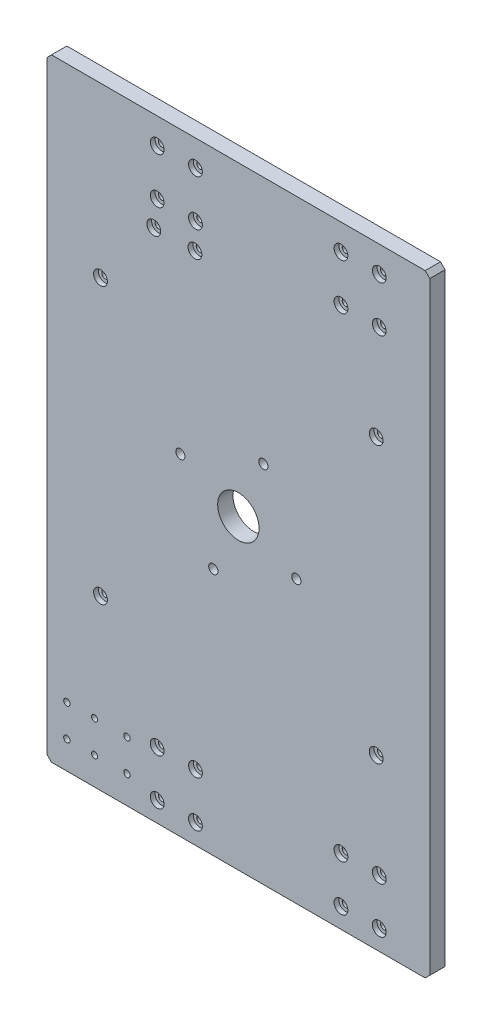
from build123d import *

# Parameters (mm, degrees)
ESQUISSE1_W                                  = 250
ESQUISSE1_H                                  = 400
BOSS_EXTRU_1_DEPTH                           = 10
ESQUISSE2_R                                  = 13.5
ENL_V_MAT_EXTRU_1_DEPTH                      = 237.061432682
CHANFREIN1_SIZE                              = 3
TROU_TARAUD_M51_D                            = 4.2
TROUS_DE_CENTRAGE_4_0MM2_D                   = 4
TROUS_DE_CENTRAGE_6_0MM2_D                   = 6
D_GAGEMENT_M41_D                             = 4.5
R_P_TITION_LIN_AIRE1_COUNT                   = 2
R_P_TITION_LIN_AIRE1_PITCH                   = 120
R_P_TITION_LIN_AIRE1_COUNT_DIR2              = 2
R_P_TITION_LIN_AIRE1_PITCH_DIR2              = 340
R_P_TITION_LIN_AIRE2_COUNT                   = 2
R_P_TITION_LIN_AIRE2_PITCH                   = 30
R_P_TITION_LIN_AIRE2_COUNT_DIR2              = 2
R_P_TITION_LIN_AIRE2_PITCH_DIR2              = 25
R_P_TITION_LIN_AIRE3_COUNT                   = 2
R_P_TITION_LIN_AIRE3_PITCH                   = 120
R_P_TITION_LIN_AIRE3_COUNT_DIR2              = 2
R_P_TITION_LIN_AIRE3_PITCH_DIR2              = 340
D_GAGEMENT_M42_D                             = 4.5
CHAMBRAGE_POUR_VIS_T_TE_RONDE_BOMB_2_A_COUNT = 2
CHAMBRAGE_POUR_VIS_T_TE_RONDE_BOMB_2_A_PITCH = 180
CHAMBRAGE_POUR_VIS_T_TE_RONDE_BOMB_3_COUNT   = 2
CHAMBRAGE_POUR_VIS_T_TE_RONDE_BOMB_3_PITCH   = 180
CHAMBRAGE_POUR_VIS_T_TE_RONDE_BOMB_4_COUNT   = 2
CHAMBRAGE_POUR_VIS_T_TE_RONDE_BOMB_4_PITCH   = 254.558441227
D_GAGEMENT_M43_D                             = 4.5
CHAMBRAGE_POUR_VIS_T_TE_RONDE_BOMB_5_A_COUNT = 2
CHAMBRAGE_POUR_VIS_T_TE_RONDE_BOMB_5_A_PITCH = 26.858717456


with BuildPart() as part:
    # Esquisse1 → Boss.-Extru.1 (new body)
    with BuildSketch(Plane.XY):
        Rectangle(ESQUISSE1_W, ESQUISSE1_H)
    extrude(amount=BOSS_EXTRU_1_DEPTH)

    # Esquisse2 → Enlèv. mat.-Extru.1 (cut, through all)
    with BuildSketch(Plane(origin=(0, 0, 0), x_dir=(-1, 0, 0), z_dir=(0, 0, -1))):
        Circle(ESQUISSE2_R)
    extrude(amount=-ENL_V_MAT_EXTRU_1_DEPTH, mode=Mode.SUBTRACT)

    # Chanfrein1
    chanfrein1_edges = [part.edges().sort_by_distance(p)[0] for p in [
        (125, -200, 5),
        (-125, -200, 5),
        (-125, 200, 5),
        (125, 200, 5),
    ]]
    chamfer(chanfrein1_edges, length=CHANFREIN1_SIZE)

    # Trou taraudé M51 (through all)
    with Locations(Plane.XY.offset(10)):
        with Locations((-72.698486264, -161.07971462), (-72.698486264, -181.838730229), (-111.937151978, -181.838730229), (-111.937151978, -161.07971462)):
            Hole(TROU_TARAUD_M51_D / 2)

    # Trous de centrage Ø4.0mm2 (through all)
    with Locations(Plane.XY.offset(10)):
        with Locations((-93.86308218, -161.07971462), (-93.86308218, -181.838730229)):
            Hole(TROUS_DE_CENTRAGE_4_0MM2_D / 2)

    # Trous de centrage Ø6.0mm2 (through all)
    with Locations(Plane.XY.offset(10)):
        with Locations((16.357059687, 37.86831259), (37.86831259, -16.357059687), (-16.357059687, -37.86831259), (-37.86831259, 16.357059687)):
            Hole(TROUS_DE_CENTRAGE_6_0MM2_D / 2)

    # Dégagement M41 (through all)
    with Locations(Plane(origin=(0, 0, 0), x_dir=(-1, 0, 0), z_dir=(0, 0, -1))):
        with Locations((28, -187), (28, -157), (53, -157), (53, -187)):
            d_gagement_m41 = Hole(D_GAGEMENT_M41_D / 2)

    # Répétition linéaire1: D_gagement M41 2 × 2
    with Locations(*[(i * R_P_TITION_LIN_AIRE1_PITCH, j * R_P_TITION_LIN_AIRE1_PITCH_DIR2, 0) for i in range(R_P_TITION_LIN_AIRE1_COUNT) for j in range(R_P_TITION_LIN_AIRE1_COUNT_DIR2) if (i, j) != (0, 0)]):
        add(d_gagement_m41, mode=Mode.SUBTRACT)

    # Esquisse29 → Chambrage pour vis _ t_te ronde bomb_e M (revolve, cut)
    with BuildSketch(Plane(origin=(92, -157, 10), x_dir=(0, -1, 0), z_dir=(1, 0, 0))):
        Polygon((0, 0), (0, 10), (2.25, 10), (2.25, 3.125), (2.275, 3.1), (4.5, 3.1), (4.5, 0), align=None)
    chambrage_pour_vis_t_te_ronde_bomb_e_m = revolve(axis=Axis((92, -157, 16.35), (0, 0, -1)), mode=Mode.SUBTRACT)

    # Répétition linéaire2: Chambrage pour vis _ t_te ronde bomb_e M 2 × 2
    with Locations(*[(-j * R_P_TITION_LIN_AIRE2_PITCH_DIR2, -i * R_P_TITION_LIN_AIRE2_PITCH, 0) for i in range(R_P_TITION_LIN_AIRE2_COUNT) for j in range(R_P_TITION_LIN_AIRE2_COUNT_DIR2) if (i, j) != (0, 0)]):
        add(chambrage_pour_vis_t_te_ronde_bomb_e_m, mode=Mode.SUBTRACT)

    # Répétition linéaire3: Chambrage pour vis _ t_te ronde bomb_e M 2 × 2
    with Locations(*[(-i * R_P_TITION_LIN_AIRE3_PITCH, j * R_P_TITION_LIN_AIRE3_PITCH_DIR2, 0) for i in range(R_P_TITION_LIN_AIRE3_COUNT) for j in range(R_P_TITION_LIN_AIRE3_COUNT_DIR2) if (i, j) != (0, 0)]):
        add(chambrage_pour_vis_t_te_ronde_bomb_e_m, mode=Mode.SUBTRACT)

    # Répétition linéaire3 copy 1 sketch → Répétition linéaire3 copy 1 (revolve, cut)
    with BuildSketch(Plane(origin=(67, 183, 10), x_dir=(0, -1, 0), z_dir=(1, 0, 0))):
        Polygon((0, 0), (0, 10), (2.25, 10), (2.25, 3.125), (2.275, 3.1), (4.5, 3.1), (4.5, 0), align=None)
    revolve(axis=Axis((67, 183, 16.35), (0, 0, -1)), mode=Mode.SUBTRACT)

    # Répétition linéaire3 copy 2 sketch → Répétition linéaire3 copy 2 (revolve, cut)
    with BuildSketch(Plane(origin=(-53, -157, 10), x_dir=(0, -1, 0), z_dir=(1, 0, 0))):
        Polygon((0, 0), (0, 10), (2.25, 10), (2.25, 3.125), (2.275, 3.1), (4.5, 3.1), (4.5, 0), align=None)
    revolve(axis=Axis((-53, -157, 16.35), (0, 0, -1)), mode=Mode.SUBTRACT)

    # Répétition linéaire3 copy 3 sketch → Répétition linéaire3 copy 3 (revolve, cut)
    with BuildSketch(Plane(origin=(-53, 183, 10), x_dir=(0, -1, 0), z_dir=(1, 0, 0))):
        Polygon((0, 0), (0, 10), (2.25, 10), (2.25, 3.125), (2.275, 3.1), (4.5, 3.1), (4.5, 0), align=None)
    revolve(axis=Axis((-53, 183, 16.35), (0, 0, -1)), mode=Mode.SUBTRACT)

    # Répétition linéaire3 copy 4 sketch → Répétition linéaire3 copy 4 (revolve, cut)
    with BuildSketch(Plane(origin=(92, 153, 10), x_dir=(0, -1, 0), z_dir=(1, 0, 0))):
        Polygon((0, 0), (0, 10), (2.25, 10), (2.25, 3.125), (2.275, 3.1), (4.5, 3.1), (4.5, 0), align=None)
    revolve(axis=Axis((92, 153, 16.35), (0, 0, -1)), mode=Mode.SUBTRACT)

    # Répétition linéaire3 copy 5 sketch → Répétition linéaire3 copy 5 (revolve, cut)
    with BuildSketch(Plane(origin=(-28, -187, 10), x_dir=(0, -1, 0), z_dir=(1, 0, 0))):
        Polygon((0, 0), (0, 10), (2.25, 10), (2.25, 3.125), (2.275, 3.1), (4.5, 3.1), (4.5, 0), align=None)
    revolve(axis=Axis((-28, -187, 16.35), (0, 0, -1)), mode=Mode.SUBTRACT)

    # Répétition linéaire3 copy 6 sketch → Répétition linéaire3 copy 6 (revolve, cut)
    with BuildSketch(Plane(origin=(-28, 153, 10), x_dir=(0, -1, 0), z_dir=(1, 0, 0))):
        Polygon((0, 0), (0, 10), (2.25, 10), (2.25, 3.125), (2.275, 3.1), (4.5, 3.1), (4.5, 0), align=None)
    revolve(axis=Axis((-28, 153, 16.35), (0, 0, -1)), mode=Mode.SUBTRACT)

    # Répétition linéaire3 copy 7 sketch → Répétition linéaire3 copy 7 (revolve, cut)
    with BuildSketch(Plane(origin=(67, 153, 10), x_dir=(0, -1, 0), z_dir=(1, 0, 0))):
        Polygon((0, 0), (0, 10), (2.25, 10), (2.25, 3.125), (2.275, 3.1), (4.5, 3.1), (4.5, 0), align=None)
    revolve(axis=Axis((67, 153, 16.35), (0, 0, -1)), mode=Mode.SUBTRACT)

    # Répétition linéaire3 copy 8 sketch → Répétition linéaire3 copy 8 (revolve, cut)
    with BuildSketch(Plane(origin=(-53, -187, 10), x_dir=(0, -1, 0), z_dir=(1, 0, 0))):
        Polygon((0, 0), (0, 10), (2.25, 10), (2.25, 3.125), (2.275, 3.1), (4.5, 3.1), (4.5, 0), align=None)
    revolve(axis=Axis((-53, -187, 16.35), (0, 0, -1)), mode=Mode.SUBTRACT)

    # Répétition linéaire3 copy 9 sketch → Répétition linéaire3 copy 9 (revolve, cut)
    with BuildSketch(Plane(origin=(-53, 153, 10), x_dir=(0, -1, 0), z_dir=(1, 0, 0))):
        Polygon((0, 0), (0, 10), (2.25, 10), (2.25, 3.125), (2.275, 3.1), (4.5, 3.1), (4.5, 0), align=None)
    revolve(axis=Axis((-53, 153, 16.35), (0, 0, -1)), mode=Mode.SUBTRACT)

    # Dégagement M42 (through all)
    with Locations(Plane(origin=(0, 0, 0), x_dir=(-1, 0, 0), z_dir=(0, 0, -1))):
        with Locations((90, -90), (90, 90), (-90, 90), (-90, -90)):
            Hole(D_GAGEMENT_M42_D / 2)

    # Esquisse33 → Chambrage pour vis _ t_te ronde bomb 2 (revolve, cut)
    with BuildSketch(Plane(origin=(-90, -90, 10), x_dir=(0, -1, 0), z_dir=(1, 0, 0))):
        Polygon((0, 0), (0, 10), (2.25, 10), (2.25, 3.125), (2.275, 3.1), (4.5, 3.1), (4.5, 0), align=None)
    chambrage_pour_vis_t_te_ronde_bomb_2 = revolve(axis=Axis((-90, -90, 16.35), (0, 0, -1)), mode=Mode.SUBTRACT)

    # Chambrage pour vis _ t_te ronde bomb 2 a: Chambrage pour vis _ t_te ronde bomb 2 ×2
    with Locations(*[(0, i * CHAMBRAGE_POUR_VIS_T_TE_RONDE_BOMB_2_A_PITCH, 0) for i in range(1, CHAMBRAGE_POUR_VIS_T_TE_RONDE_BOMB_2_A_COUNT)]):
        add(chambrage_pour_vis_t_te_ronde_bomb_2, mode=Mode.SUBTRACT)

    # Chambrage pour vis _ t_te ronde bomb 3: Chambrage pour vis _ t_te ronde bomb 2 ×2
    with Locations(*[(i * CHAMBRAGE_POUR_VIS_T_TE_RONDE_BOMB_3_PITCH, 0, 0) for i in range(1, CHAMBRAGE_POUR_VIS_T_TE_RONDE_BOMB_3_COUNT)]):
        add(chambrage_pour_vis_t_te_ronde_bomb_2, mode=Mode.SUBTRACT)

    # Chambrage pour vis _ t_te ronde bomb 4: Chambrage pour vis _ t_te ronde bomb 2 ×2
    with Locations(*[Vector(0.7071067811864814, 0.7071067811866137, 0) * (i * CHAMBRAGE_POUR_VIS_T_TE_RONDE_BOMB_4_PITCH) for i in range(1, CHAMBRAGE_POUR_VIS_T_TE_RONDE_BOMB_4_COUNT)]):
        add(chambrage_pour_vis_t_te_ronde_bomb_2, mode=Mode.SUBTRACT)

    # Dégagement M43 (through all)
    with Locations(Plane(origin=(0, 0, 0), x_dir=(-1, 0, 0), z_dir=(0, 0, -1))):
        with Locations((55.199022773, 135.70653433), (28.341819814, 135.991758108)):
            Hole(D_GAGEMENT_M43_D / 2)

    # Esquisse37 → Chambrage pour vis _ t_te ronde bomb 5 (revolve, cut)
    with BuildSketch(Plane(origin=(-55.199022773, 135.70653433, 10), x_dir=(0, -1, 0), z_dir=(1, 0, 0))):
        Polygon((0, 0), (0, 10), (2.25, 10), (2.25, 3.125), (2.275, 3.1), (4.5, 3.1), (4.5, 0), align=None)
    chambrage_pour_vis_t_te_ronde_bomb_5 = revolve(axis=Axis((-55.199022773, 135.70653433, 16.35), (0, 0, -1)), mode=Mode.SUBTRACT)

    # Chambrage pour vis _ t_te ronde bomb 5 a: Chambrage pour vis _ t_te ronde bomb 5 ×2
    with Locations(*[Vector(0.9999436124580966, 0.010619411671655749, 0) * (i * CHAMBRAGE_POUR_VIS_T_TE_RONDE_BOMB_5_A_PITCH) for i in range(1, CHAMBRAGE_POUR_VIS_T_TE_RONDE_BOMB_5_A_COUNT)]):
        add(chambrage_pour_vis_t_te_ronde_bomb_5, mode=Mode.SUBTRACT)


solid = part.part
